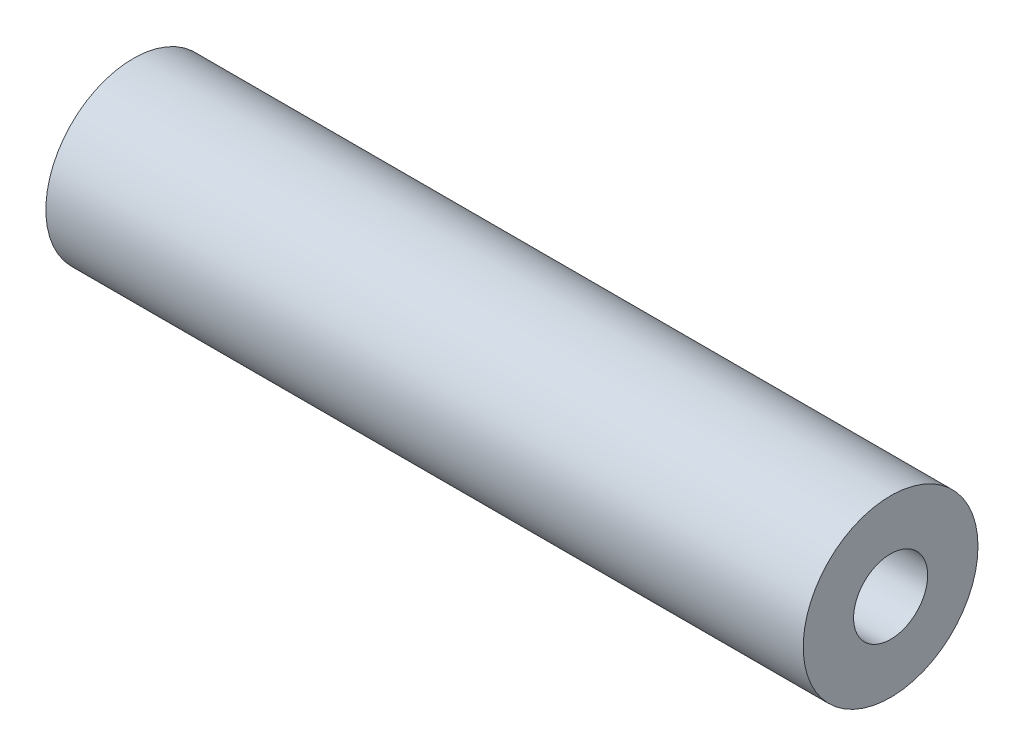
from build123d import *

# Parameters (mm, degrees)
SKETCH1_R                            = 4.7625
BOSS_EXTRUDE1_DEPTH                  = 20.6375
F_10_32_TAPPED_HOLE1_D               = 4.0386
F_10_32_TAPPED_HOLE1_DEPTH           = 16.256
F_10_32_TAPPED_HOLE1_TIP             = 1.213317848
F_10_32_TAPPED_HOLE1_ON_FACE_2_D     = 4.0386
F_10_32_TAPPED_HOLE1_ON_FACE_2_DEPTH = 16.256
F_10_32_TAPPED_HOLE1_ON_FACE_2_TIP   = 1.213317848


with BuildPart() as part:
    # Sketch1 → Boss-Extrude1 (new, symmetric)
    with BuildSketch(Plane(origin=(0, 0, 0), x_dir=(0, 0, -1), z_dir=(1, 0, 0))):
        Circle(SKETCH1_R)
    extrude(amount=BOSS_EXTRUDE1_DEPTH, both=True)

    # #10-32 Tapped Hole1
    with Locations(Plane(origin=(20.6375, 0, 0), x_dir=(0, 0, 1), z_dir=(1, 0, 0))):
        with Locations((0, 0)):
            Hole(F_10_32_TAPPED_HOLE1_D / 2, depth=F_10_32_TAPPED_HOLE1_DEPTH)
            with Locations((0, 0, -(F_10_32_TAPPED_HOLE1_DEPTH + F_10_32_TAPPED_HOLE1_TIP / 2))):  # 118° drill point
                Cone(0, F_10_32_TAPPED_HOLE1_D / 2, F_10_32_TAPPED_HOLE1_TIP, mode=Mode.SUBTRACT)

    # #10-32 Tapped Hole1 on face 2
    with Locations(Plane(origin=(-20.6375, 0, 0), x_dir=(0, 0, -1), z_dir=(-1, 0, 0))):
        with Locations((0, 0)):
            Hole(F_10_32_TAPPED_HOLE1_ON_FACE_2_D / 2, depth=F_10_32_TAPPED_HOLE1_ON_FACE_2_DEPTH)
            with Locations((0, 0, -(F_10_32_TAPPED_HOLE1_ON_FACE_2_DEPTH + F_10_32_TAPPED_HOLE1_ON_FACE_2_TIP / 2))):  # 118° drill point
                Cone(0, F_10_32_TAPPED_HOLE1_ON_FACE_2_D / 2, F_10_32_TAPPED_HOLE1_ON_FACE_2_TIP, mode=Mode.SUBTRACT)


solid = part.part
